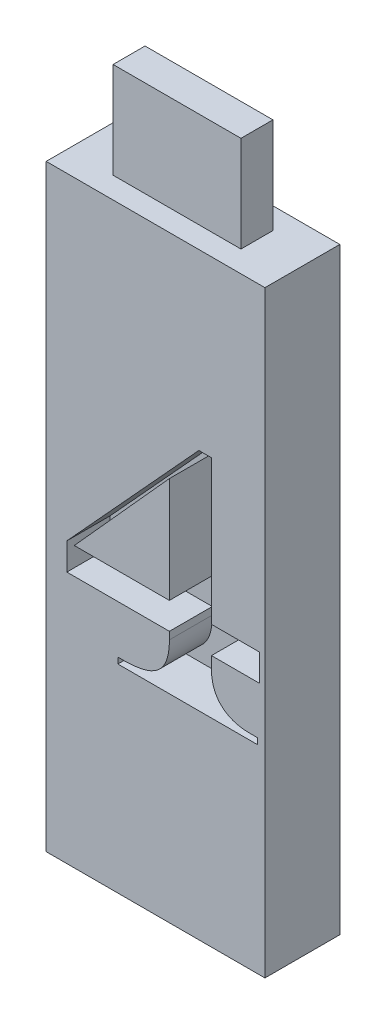
from build123d import *

# Parameters (mm, degrees)
SKETCH1_W           = 17.38
SKETCH1_H           = 47.498
BOSS_EXTRUDE1_DEPTH = 5.95
CUT_EXTRUDE1_DEPTH  = 3.41
SKETCH3_W           = 10.16
SKETCH3_H           = 2.54
BOSS_EXTRUDE2_DEPTH = 7.62


with BuildPart() as part:
    # Sketch1 → Boss-Extrude1 (new body)
    with BuildSketch(Plane.XY):
        Rectangle(SKETCH1_W, SKETCH1_H)
    extrude(amount=BOSS_EXTRUDE1_DEPTH)

    # Sketch2 → Cut-Extrude1 (cut)
    with BuildSketch(Plane.XY.offset(5.95)):
        with BuildLine():
            Line((3.438639944, 9.924455156), (4.442467735, 9.924455156))
            Line((4.442467735, 9.924455156), (4.442467735, -1.539332851))
            Line((4.442467735, -1.539332851), (8.256267, -1.539332851))
            Line((8.256267, -1.539332851), (8.256267, -3.688793102))
            Line((8.256267, -3.688793102), (4.442467735, -3.688793102))
            Line((4.442467735, -3.688793102), (4.442467735, -4.640377068))
            add(Edge.make_bspline(
                [(4.442467735, -4.640377068), (4.443669751, -4.751273799), (4.44601529, -4.967670812), (4.491573849, -5.280067729), (4.547428573, -5.576451443), (4.638679375, -5.850580816), (4.750284326, -6.109988852), (4.893045349, -6.345559529), (5.054243786, -6.56764849), (5.24539936, -6.764114691), (5.45895144, -6.939280612), (5.690437988, -7.094166195), (5.94412251, -7.21948209), (6.213330934, -7.330421399), (6.505331291, -7.411643013), (6.816896163, -7.464731494), (7.145657743, -7.505427509), (7.371717246, -7.508487842), (7.487536425, -7.510055771)],
                knots=[0, 0, 0, 0, 1.118672576, 2.182908393, 3.183164075, 4.160436979, 5.09410661, 6.029127428, 6.936133637, 7.860118871, 8.788194062, 9.721948199, 10.665788183, 11.640878679, 12.658961174, 13.718515742, 14.83110584, 16, 16, 16, 16], degree=3))
            Line((7.487536425, -7.510055771), (8.080877015, -7.510055771))
            Line((8.080877015, -7.510055771), (8.080877015, -7.987713605))
            Line((8.080877015, -7.987713605), (-2.994814002, -7.987713605))
            Line((-2.994814002, -7.987713605), (-2.994814002, -7.510055771))
            Line((-2.994814002, -7.510055771), (-2.453717238, -7.510055771))
            add(Edge.make_bspline(
                [(-2.453717238, -7.510055771), (-2.258238674, -7.505911681), (-1.884825234, -7.49799542), (-1.351318965, -7.434422338), (-0.871964817, -7.331943938), (-0.442786011, -7.18885029), (-0.068953302, -6.991569685), (0.256975704, -6.754501307), (0.523821338, -6.462132653), (0.738539375, -6.124798114), (0.904653386, -5.736728404), (1.016200957, -5.296067491), (1.08879249, -4.804482414), (1.095404798, -4.459053985), (1.0988629, -4.278401991)],
                knots=[0, 0, 0, 0, 1.266752721, 2.419817719, 3.476234114, 4.440044039, 5.341650734, 6.205967801, 7.039034094, 7.891156267, 8.786794986, 9.762669761, 10.829922107, 12, 12, 12, 12], degree=3))
            Line((1.0988629, -4.278401991), (1.0988629, -3.688793102))
            Line((1.0988629, -3.688793102), (-7.047442184, -3.688793102))
            Line((-7.047442184, -3.688793102), (-7.047442184, -1.539332851))
            Line((-7.047442184, -1.539332851), (3.438639944, 9.924455156))
        make_face()
        Polygon((1.0988629, 6.819679237), (-6.457833296, -1.565454764), (1.0988629, -1.565454764), align=None, mode=Mode.SUBTRACT)
    extrude(amount=-CUT_EXTRUDE1_DEPTH, mode=Mode.SUBTRACT)

    # Sketch3 → Boss-Extrude2 (add)
    with BuildSketch(Plane(origin=(0, 23.749, 0), x_dir=(1, 0, 0), z_dir=(0, 1, 0))):
        with Locations((0, -2.975)):
            Rectangle(SKETCH3_W, SKETCH3_H)
    extrude(amount=BOSS_EXTRUDE2_DEPTH)


solid = part.part
